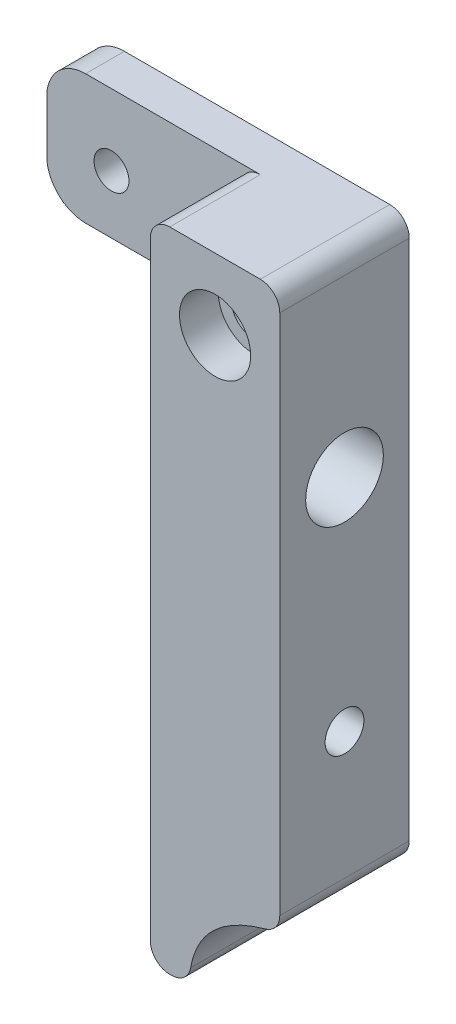
from build123d import *

# Parameters (mm, degrees)
SKETCH1_W           = 10
SKETCH1_H           = 50
BOSS_EXTRUDE1_DEPTH = 10
SKETCH2_R           = 1.75
CUT_EXTRUDE1_DEPTH  = 10
CUT_EXTRUDE2_DEPTH  = 10
FILLET1_R           = 1.5
SKETCH4_R           = 2.75
CUT_EXTRUDE3_DEPTH  = 3
SKETCH5_R           = 3
CUT_EXTRUDE4_DEPTH  = 13
SKETCH6_W           = 3
SKETCH6_H           = 10
BOSS_EXTRUDE2_DEPTH = 15
FILLET2_R           = 3
FILLET3_R           = 1.5
SKETCH7_R           = 1.35
CUT_EXTRUDE5_DEPTH  = 15
SKETCH8_R           = 1.5
CUT_EXTRUDE6_DEPTH  = 15


with BuildPart() as part:
    # Sketch1 → Boss-Extrude1 (new body)
    with BuildSketch(Plane.XY):
        Rectangle(SKETCH1_W, SKETCH1_H)
    extrude(amount=BOSS_EXTRUDE1_DEPTH)

    # Sketch2 → Cut-Extrude1 (cut)
    with BuildSketch(Plane.XY.offset(10)):
        with Locations((0, 19.5)):
            Circle(SKETCH2_R)
    extrude(amount=-CUT_EXTRUDE1_DEPTH, mode=Mode.SUBTRACT)

    # Sketch3 → Cut-Extrude2 (cut)
    with BuildSketch(Plane.XY.offset(10)):
        with BuildLine():
            Line((5, -18), (5, -25))
            Line((5, -25), (-2, -25))
            add(Edge.make_bspline(
                [(-2, -25), (-1.904224842, -19.430935455), (5, -18)],
                knots=[0, 0, 0, 1, 1, 1], degree=2))
        make_face()
    extrude(amount=-CUT_EXTRUDE2_DEPTH, mode=Mode.SUBTRACT)

    # Fillet1
    fillet1_edges = [part.edges().sort_by_distance(p)[0] for p in [
        (5, -18, 5),
        (-2, -25, 5),
        (-5, -25, 5),
        (5, 25, 5),
    ]]
    fillet(fillet1_edges, radius=FILLET1_R)

    # Sketch4 → Cut-Extrude3 (cut)
    with BuildSketch(Plane.XY.offset(10)):
        with Locations((0, 19.5)):
            Circle(SKETCH4_R)
    extrude(amount=-CUT_EXTRUDE3_DEPTH, mode=Mode.SUBTRACT)

    # Sketch5 → Cut-Extrude4 (cut)
    with BuildSketch(Plane(origin=(5, 0, 0), x_dir=(0, 0, -1), z_dir=(1, 0, 0))):
        with Locations(Location((-5, 10, 0), (0, 0, 90))):
            Circle(SKETCH5_R)
    extrude(amount=-CUT_EXTRUDE4_DEPTH, mode=Mode.SUBTRACT)

    # Sketch6 → Boss-Extrude2 (add)
    with BuildSketch(Plane.ZY.offset(5)):
        with Locations((1.5, 20)):
            Rectangle(SKETCH6_W, SKETCH6_H)
    extrude(amount=BOSS_EXTRUDE2_DEPTH)

    # Fillet2
    fillet2_edges = [part.edges().sort_by_distance(p)[0] for p in [
        (-20, 15, 1.5),
        (-20, 25, 1.5),
    ]]
    fillet(fillet2_edges, radius=FILLET2_R)

    # Fillet3
    fillet3_edges = [part.edges().sort_by_distance(p)[0] for p in [
        (-5, 25, 6.5),
    ]]
    fillet(fillet3_edges, radius=FILLET3_R)

    # Sketch7 → Cut-Extrude5 (cut)
    with BuildSketch(Plane.XY.offset(3)):
        with Locations((-15, 19.5)):
            Circle(SKETCH7_R)
    extrude(amount=-CUT_EXTRUDE5_DEPTH, mode=Mode.SUBTRACT)

    # Sketch8 → Cut-Extrude6 (cut)
    with BuildSketch(Plane(origin=(5, 0, 0), x_dir=(0, 0, -1), z_dir=(1, 0, 0))):
        with Locations(Location((-5, -7, 0), (0, 0, 90))):
            Circle(SKETCH8_R)
    extrude(amount=-CUT_EXTRUDE6_DEPTH, mode=Mode.SUBTRACT)


solid = part.part
